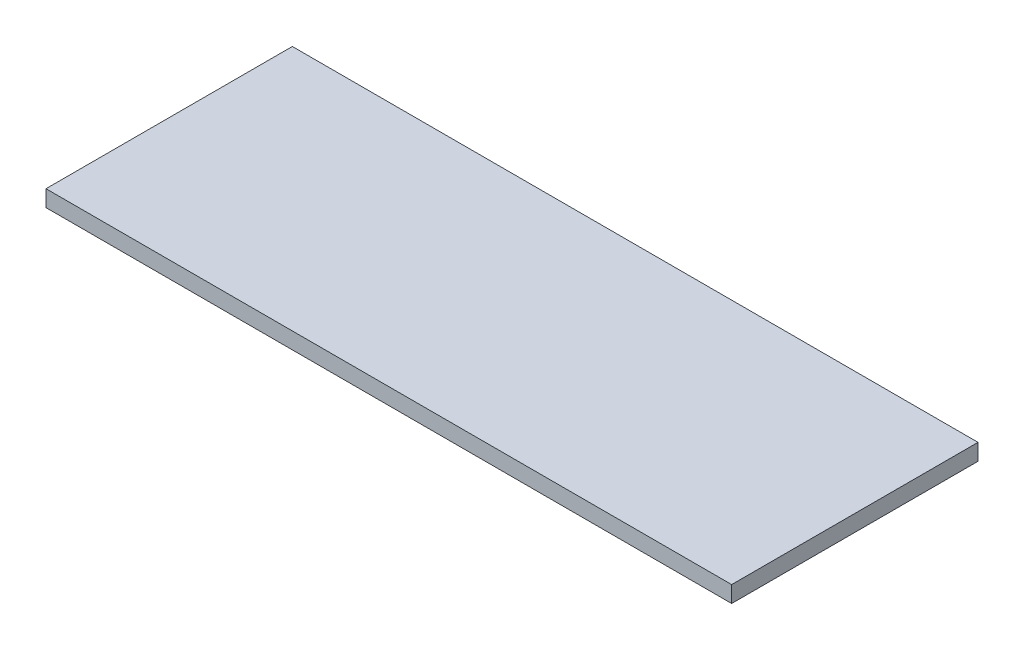
from build123d import *

# Parameters (mm, degrees)
SCHIZZO1_W                   = 167
SCHIZZO1_H                   = 60
ESTRUSIONE_ESTRUSIONE1_DEPTH = 4


with BuildPart() as part:
    # Schizzo1 → Estrusione-Estrusione1 (new body)
    with BuildSketch(Plane(origin=(0, 0, 0), x_dir=(1, 0, 0), z_dir=(0, 1, 0))):
        Rectangle(SCHIZZO1_W, SCHIZZO1_H)
    extrude(amount=ESTRUSIONE_ESTRUSIONE1_DEPTH)


solid = part.part
